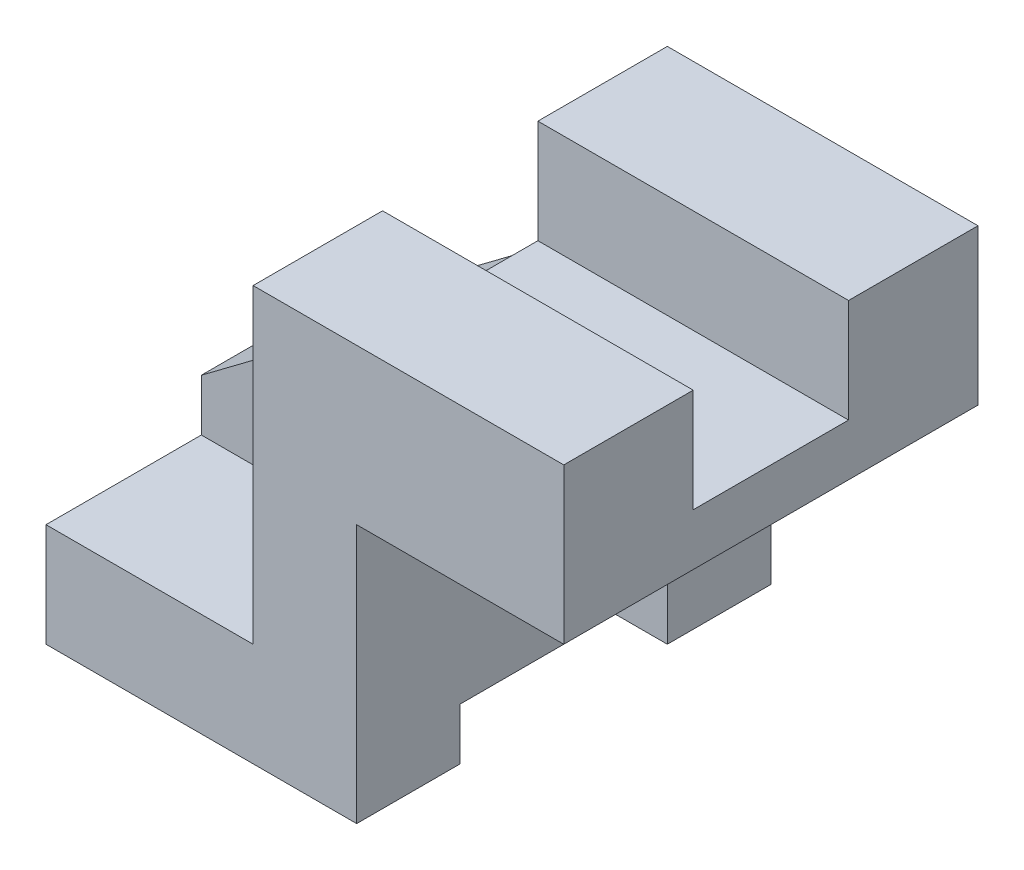
from build123d import *

# Parameters (mm, degrees)
BOSS_EXTRUDE1_DEPTH = 40
BOSS_EXTRUDE2_DEPTH = 10
SKETCH2_W           = 40
SKETCH2_H           = 10
SKETCH2_W_2         = 30
SKETCH2_H_2         = 20
CUT_EXTRUDE1_DEPTH  = 135.16407865


with BuildPart() as part:
    # Sketch1 → Boss-Extrude1 (new, symmetric)
    with BuildSketch(Plane.XY):
        Polygon((0, 20), (0, 0), (60, 0), (60, 50), (100, 50), (100, 80), (40, 80), (40, 60), (40, 20), align=None)
    extrude(amount=BOSS_EXTRUDE1_DEPTH, both=True)

    # Sketch1<3> → Boss-Extrude2 (add, symmetric)
    with BuildSketch(Plane.XY):
        Polygon((0, 30), (0, 20), (40, 20), (40, 60), align=None)
    extrude(amount=BOSS_EXTRUDE2_DEPTH, both=True)

    # Sketch2 → Cut-Extrude1 (cut, through all)
    with BuildSketch(Plane(origin=(0, 0, 0), x_dir=(0, 0, -1), z_dir=(1, 0, 0))):
        with Locations((0, 5)):
            Rectangle(SKETCH2_W, SKETCH2_H)
        with Locations((0, 70)):
            Rectangle(SKETCH2_W_2, SKETCH2_H_2)
    extrude(amount=CUT_EXTRUDE1_DEPTH, mode=Mode.SUBTRACT)


solid = part.part
